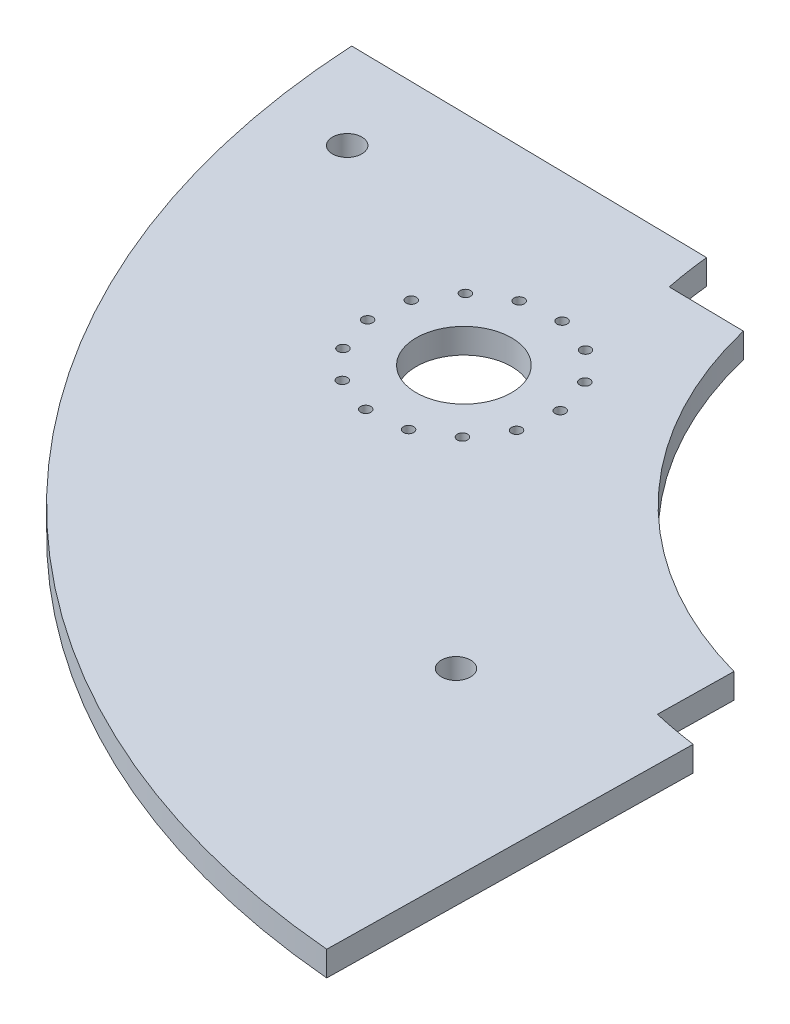
from build123d import *

# Parameters (mm, degrees)
SKETCH1_R               = 0.35
SKETCH1_R_2             = 3.25
BOSS_EXTRUDE1_DEPTH     = 1.7
CUT_EXTRUDE9_DEPTH      = 92.720556649
CUT_EXTRUDE9_DEPTH_BACK = 8
SKETCH10_R              = 1


with BuildPart() as part:
    # Sketch1 → Boss-Extrude1 (new body)
    with BuildSketch(Plane(origin=(0, 0, 0), x_dir=(0.9998727759206639, 0, 0.01595092388251767), z_dir=(0, 1, 0))):
        with BuildLine():
            Line((-2.997717637, -22.894746364), (-2.997717637, -27.430964436))
            ThreePointArc((-2.997717637, -27.430964436), (-1.503571481, -27.719382228), (0.002282363, -27.938612151))
            Line((0.002282363, -27.938612151), (0.002282363, -52.542634275))
            ThreePointArc((0.002282363, -52.542634275), (-36.656357556, -35.840573361), (-53.35841847, 0.818066557))
            Line((-53.35841847, 0.818066557), (-28.754396346, 0.818066557))
            ThreePointArc((-28.754396346, 0.818066557), (-28.535166423, -0.687787287), (-28.246748631, -2.181933443))
            Line((-28.246748631, -2.181933443), (-23.710530558, -2.181933443))
            Line((-23.710530558, -2.181933443), (-23.108601061, -2.181933443))
            ThreePointArc((-23.108601061, -2.181933443), (-15.796707511, -14.980923316), (-2.997717637, -22.292816866))
            Line((-2.997717637, -22.292816866), (-2.997717637, -22.894746364))
        make_face()
        with Locations(Location((-27.264431182, -8.755704918, 0), (0, 0, 90.913959377))):
            Circle(SKETCH1_R, mode=Mode.SUBTRACT)
        with Locations(Location((-25.368580215, -10.636127908, 0), (0, 0, 90.913959377))):
            Circle(SKETCH1_R, mode=Mode.SUBTRACT)
        with Locations(Location((-24.476362472, -13.152909386, 0), (0, 0, 90.913959377))):
            Circle(SKETCH1_R, mode=Mode.SUBTRACT)
        with Locations(Location((-24.764492621, -15.807569916, 0), (0, 0, 90.913959377))):
            Circle(SKETCH1_R, mode=Mode.SUBTRACT)
        with Locations(Location((-26.175902952, -18.074321422, 0), (0, 0, 90.913959377))):
            Circle(SKETCH1_R, mode=Mode.SUBTRACT)
        with Locations(Location((-28.431046339, -19.504205968, 0), (0, 0, 90.913959377))):
            Circle(SKETCH1_R, mode=Mode.SUBTRACT)
        with Locations(Location((-31.083263977, -19.814017383, 0), (0, 0, 90.913959377))):
            Circle(SKETCH1_R, mode=Mode.SUBTRACT)
        with Locations(Location((-33.607251635, -18.942393718, 0), (0, 0, 90.913959377))):
            Circle(SKETCH1_R, mode=Mode.SUBTRACT)
        with Locations(Location((-35.503102603, -17.061970729, 0), (0, 0, 90.913959377))):
            Circle(SKETCH1_R, mode=Mode.SUBTRACT)
        with Locations(Location((-36.395320345, -14.54518925, 0), (0, 0, 90.913959377))):
            Circle(SKETCH1_R, mode=Mode.SUBTRACT)
        with Locations(Location((-36.107190196, -11.890528721, 0), (0, 0, 90.913959377))):
            Circle(SKETCH1_R, mode=Mode.SUBTRACT)
        with Locations(Location((-34.695779865, -9.623777215, 0), (0, 0, 90.913959377))):
            Circle(SKETCH1_R, mode=Mode.SUBTRACT)
        with Locations(Location((-32.440636478, -8.193892669, 0), (0, 0, 90.913959377))):
            Circle(SKETCH1_R, mode=Mode.SUBTRACT)
        with Locations(Location((-29.78841884, -7.884081253, 0), (0, 0, 90.913959377))):
            Circle(SKETCH1_R, mode=Mode.SUBTRACT)
        with Locations(Location((-30.435841409, -13.849049318, 0), (0, 0, 90.913959377))):
            Circle(SKETCH1_R_2, mode=Mode.SUBTRACT)
    extrude(amount=BOSS_EXTRUDE1_DEPTH)

    # Sketch10 → Cut-Extrude9 (cut, two sides: drawn at the far end of the back side and taken through both)
    with BuildSketch(Plane(origin=(0, -51.287040458, 0), x_dir=(0.9998727759206634, 0, 0.015950923882551597), z_dir=(0, 1, 0)).offset(-CUT_EXTRUDE9_DEPTH_BACK)):
        with Locations(Location((-12.504691316, -31.747044129, 0), (0, 0, 270.913959377))):
            Circle(SKETCH10_R)
        with Locations(Location((-47.53974173, -5.120311842, 0), (0, 0, 270.913959377))):
            Circle(SKETCH10_R)
    extrude(amount=CUT_EXTRUDE9_DEPTH + CUT_EXTRUDE9_DEPTH_BACK, mode=Mode.SUBTRACT)


solid = part.part
